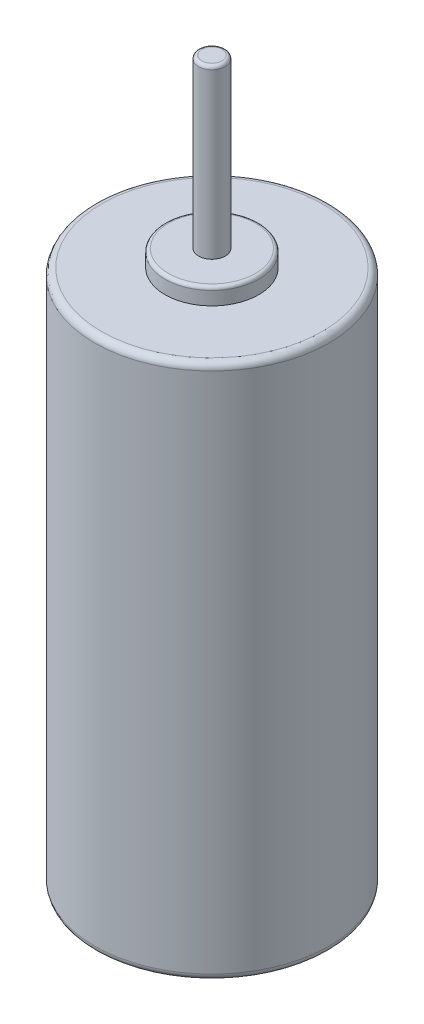
from build123d import *

# Parameters (mm, degrees)
SKETCH1_R           = 3.5
BOSS_EXTRUDE1_DEPTH = 16
SKETCH4_R           = 1.4
BOSS_EXTRUDE2_DEPTH = 0.5
SKETCH5_R           = 0.4
BOSS_EXTRUDE3_DEPTH = 5
FILLET1_R           = 0.1
FILLET2_R           = 0.2
FILLET3_R           = 0.2
FILLET4_R           = 0.1


with BuildPart() as part:
    # Sketch1 → Boss-Extrude1 (new body)
    with BuildSketch(Plane(origin=(0, 0, 0), x_dir=(1, 0, 0), z_dir=(0, 1, 0))):
        with Locations(Location((0, 0, 0), (0, 0, 270))):
            Circle(SKETCH1_R)
    extrude(amount=BOSS_EXTRUDE1_DEPTH)

    # Sketch4 → Boss-Extrude2 (add)
    with BuildSketch(Plane(origin=(0, 16, 0), x_dir=(1, 0, 0), z_dir=(0, 1, 0))):
        with Locations(Location((0, 0, 0), (0, 0, 270))):
            Circle(SKETCH4_R)
    extrude(amount=BOSS_EXTRUDE2_DEPTH)

    # Sketch5 → Boss-Extrude3 (add)
    with BuildSketch(Plane(origin=(0, 16.5, 0), x_dir=(1, 0, 0), z_dir=(0, 1, 0))):
        with Locations(Location((0, 0, 0), (0, 0, 270))):
            Circle(SKETCH5_R)
    extrude(amount=BOSS_EXTRUDE3_DEPTH)

    # Fillet1
    fillet1_edges = [part.edges().sort_by_distance(p)[0] for p in [
        (0, 21.5, -0.4),
    ]]
    fillet(fillet1_edges, radius=FILLET1_R)

    # Fillet2
    fillet2_edges = [part.edges().sort_by_distance(p)[0] for p in [
        (0, 16, -3.5),
    ]]
    fillet(fillet2_edges, radius=FILLET2_R)

    # Fillet3
    fillet3_edges = [part.edges().sort_by_distance(p)[0] for p in [
        (0, 0, -3.5),
    ]]
    fillet(fillet3_edges, radius=FILLET3_R)

    # Fillet4
    fillet4_edges = [part.edges().sort_by_distance(p)[0] for p in [
        (0, 16.5, -1.4),
    ]]
    fillet(fillet4_edges, radius=FILLET4_R)


solid = part.part
